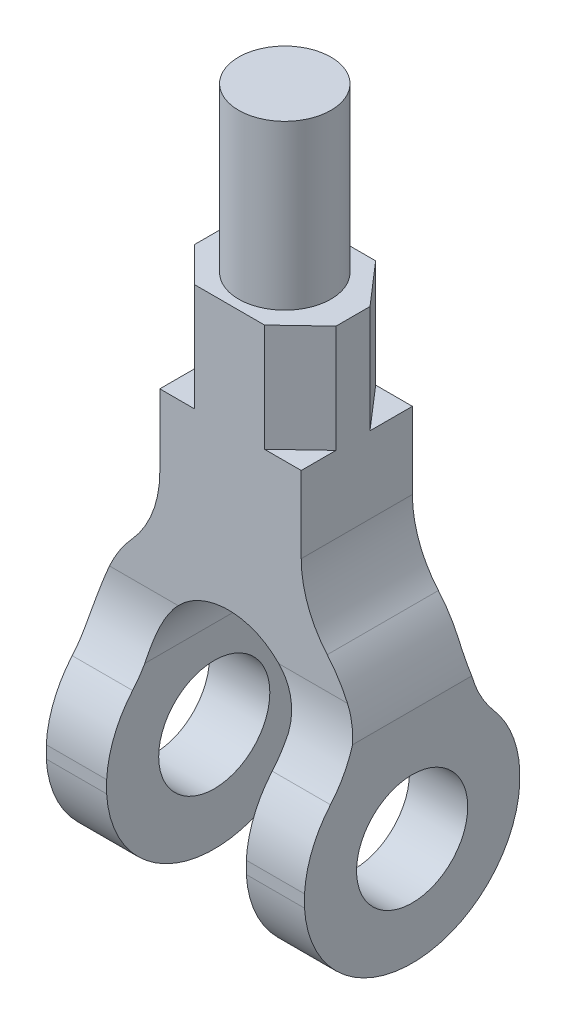
from build123d import *

# Parameters (mm, degrees)
SKETCH1_W           = 120
SKETCH1_H           = 250
BOSS_EXTRUDE1_DEPTH = 100
CUT_EXTRUDE4_DEPTH  = 296.999195185
SKETCH3_R           = 25.822682523
CUT_EXTRUDE5_DEPTH  = 295.78805946
CUT_EXTRUDE6_DEPTH  = 50
SKETCH5_R           = 21.439897113
BOSS_EXTRUDE2_DEPTH = 76


with BuildPart() as part:
    # Sketch1 → Boss-Extrude1 (new body)
    with BuildSketch(Plane.XY):
        with Locations((-62.945205479, 125)):
            Rectangle(SKETCH1_W, SKETCH1_H)
    extrude(amount=BOSS_EXTRUDE1_DEPTH)

    # Sketch2 → Cut-Extrude4 (cut, through all)
    with BuildSketch(Plane.XY.offset(100)):
        with BuildLine():
            ThreePointArc((-30.008304656, 92.477893201), (-62.446707823, 126.977893201), (-94.885110989, 92.477893201))
            Line((-94.885110989, 92.477893201), (-94.885110989, 0))
            Line((-94.885110989, 0), (-30.008304656, 0))
            Line((-30.008304656, 0), (-30.008304656, 92.477893201))
        make_face()
        with BuildLine():
            Line((-122.945205479, 250), (-122.945205479, 92.904251347))
            ThreePointArc((-122.945205479, 92.904251347), (-118.821122518, 114.436385128), (-107.294308503, 133.085068837))
            ThreePointArc((-107.294308503, 133.085068837), (-97.704359806, 148.661484818), (-94.358441298, 166.644718124))
            Line((-94.358441298, 166.644718124), (-94.358441298, 250))
            Line((-94.358441298, 250), (-122.945205479, 250))
        make_face()
        with BuildLine():
            ThreePointArc((-16.569647846, 131.918295936), (-7.86521834, 118.575996693), (-2.945205479, 103.424181106))
            Line((-2.945205479, 103.424181106), (-2.945205479, 250))
            Line((-2.945205479, 250), (-28.654722245, 250))
            Line((-28.654722245, 250), (-28.654722245, 164.513670097))
            ThreePointArc((-28.654722245, 164.513670097), (-25.536201958, 147.131873297), (-16.569647846, 131.918295936))
        make_face()
    extrude(amount=-CUT_EXTRUDE4_DEPTH, mode=Mode.SUBTRACT)

    # Sketch3 → Cut-Extrude5 (cut, through all)
    with BuildSketch(Plane(origin=(-2.945205479, 0, 0), x_dir=(0, 0, -1), z_dir=(1, 0, 0))):
        with BuildLine():
            Line((-75.822682523, 117.037988815), (-75.822682523, 250))
            Line((-75.822682523, 250), (-100, 250))
            Line((-100, 250), (-100, 164.513670097))
            Line((-100, 164.513670097), (-100, 131.918295936))
            Line((-100, 131.918295936), (-100, 103.424181106))
            Line((-100, 103.424181106), (-77.711724939, 103.424181106))
            ThreePointArc((-77.711724939, 103.424181106), (-76.297194746, 110.165866843), (-75.822682523, 117.037988815))
        make_face()
        with BuildLine():
            ThreePointArc((-87.942678111, 84.402038305), (-81.787788797, 93.35406738), (-77.711724939, 103.424181106))
            Line((-77.711724939, 103.424181106), (-100, 103.424181106))
            Line((-100, 103.424181106), (-100, 54.589503668))
            ThreePointArc((-100, 54.589503668), (-96.429252241, 70.48984448), (-87.942678111, 84.402038305))
        make_face()
        with BuildLine():
            ThreePointArc((0, 48.834677438), (-50, 1.629363928), (-100, 48.834677438))
            Line((-100, 48.834677438), (-100, 0))
            Line((-100, 0), (0, 0))
            Line((0, 0), (0, 48.834677438))
        make_face()
        with BuildLine():
            Line((0, 103.424181106), (-22.288275061, 103.424181106))
            ThreePointArc((-22.288275061, 103.424181106), (-18.212211203, 93.35406738), (-12.057321889, 84.402038305))
            ThreePointArc((-12.057321889, 84.402038305), (-3.570747759, 70.48984448), (0, 54.589503668))
            Line((0, 54.589503668), (0, 103.424181106))
        make_face()
        with BuildLine():
            Line((0, 250), (-24.177317477, 250))
            Line((-24.177317477, 250), (-24.177317477, 117.037988815))
            ThreePointArc((-24.177317477, 117.037988815), (-23.702805254, 110.165866843), (-22.288275061, 103.424181106))
            Line((-22.288275061, 103.424181106), (0, 103.424181106))
            Line((0, 103.424181106), (0, 131.918295936))
            Line((0, 131.918295936), (0, 164.513670097))
            Line((0, 164.513670097), (0, 250))
        make_face()
        with Locations((-50, 51.712090553)):
            Circle(SKETCH3_R)
    extrude(amount=-CUT_EXTRUDE5_DEPTH, mode=Mode.SUBTRACT)

    # Sketch4 → Cut-Extrude6 (cut)
    with BuildSketch(Plane(origin=(0, 250, 0), x_dir=(1, 0, 0), z_dir=(0, 1, 0))):
        Polygon((-94.358441298, -43.871698339), (-78.810697557, -24.177317477), (-94.358441298, -24.177317477), align=None)
        Polygon((-78.20485695, -75.822682523), (-94.358441298, -59.669098176), (-94.358441298, -75.822682523), align=None)
        Polygon((-28.654722245, -24.177317477), (-45.717868589, -24.177317477), (-28.654722245, -43.871698339), align=None)
        Polygon((-28.654722245, -75.822682523), (-28.654722245, -59.669098176), (-45.717868589, -75.822682523), align=None)
    extrude(amount=-CUT_EXTRUDE6_DEPTH, mode=Mode.SUBTRACT)

    # Sketch5 → Boss-Extrude2 (add)
    with BuildSketch(Plane(origin=(0, 250, 0), x_dir=(1, 0, 0), z_dir=(0, 1, 0))):
        with Locations(Location((-62.112822921, -50, 0), (0, 0, 270))):
            Circle(SKETCH5_R)
    extrude(amount=BOSS_EXTRUDE2_DEPTH)


solid = part.part
